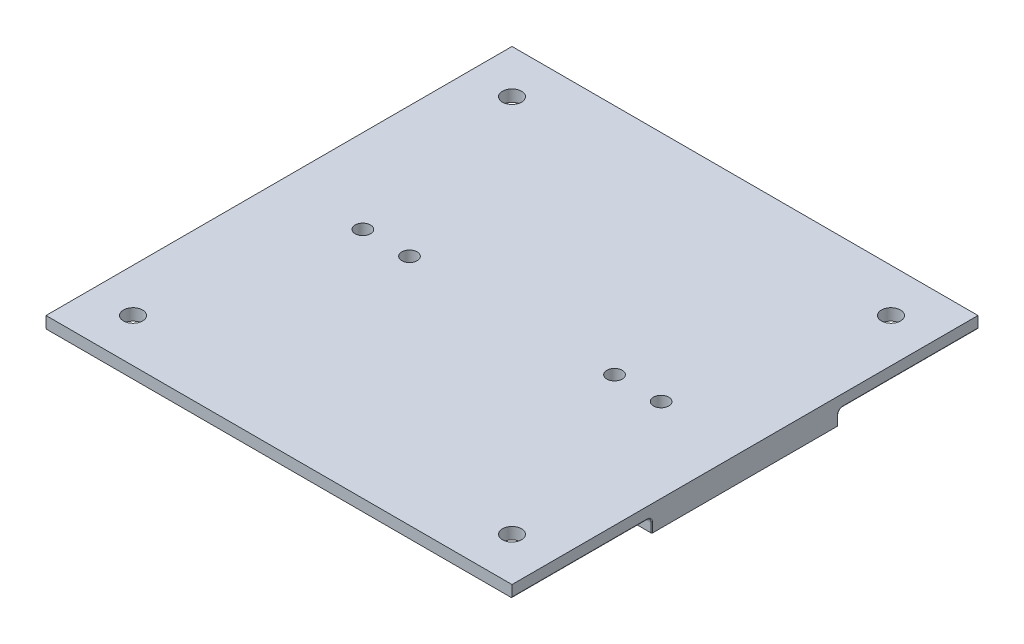
from build123d import *

# Parameters (mm, degrees)
SKETCH1_W           = 100
SKETCH1_H           = 100
SKETCH1_R           = 2.05
BOSS_EXTRUDE1_DEPTH = 2.5
SKETCH3_W           = 100
SKETCH3_H           = 40
BOSS_EXTRUDE2_DEPTH = 3
FILLET2_R           = 1
FILLET4_R           = 0.2
SKETCH4_R           = 1.65
CUT_EXTRUDE1_DEPTH  = 71.924255371


with BuildPart() as part:
    # Sketch1 → Boss-Extrude1 (new body)
    with BuildSketch(Plane(origin=(0, 0, 0), x_dir=(1, 0, 0), z_dir=(0, 1, 0))):
        Rectangle(SKETCH1_W, SKETCH1_H)
        with Locations(Location((-40.66, 40.66, 0), (0, 0, 270))):
            Circle(SKETCH1_R, mode=Mode.SUBTRACT)
        with Locations(Location((40.66, 40.66, 0), (0, 0, 270))):
            Circle(SKETCH1_R, mode=Mode.SUBTRACT)
        with Locations(Location((40.66, -40.66, 0), (0, 0, 270))):
            Circle(SKETCH1_R, mode=Mode.SUBTRACT)
        with Locations(Location((-40.66, -40.66, 0), (0, 0, 270))):
            Circle(SKETCH1_R, mode=Mode.SUBTRACT)
    extrude(amount=BOSS_EXTRUDE1_DEPTH)

    # Sketch3 → Boss-Extrude2 (add)
    with BuildSketch(Plane.XZ):
        Rectangle(SKETCH3_W, SKETCH3_H)
    extrude(amount=BOSS_EXTRUDE2_DEPTH)

    # Fillet2
    fillet2_edges = [part.edges().sort_by_distance(p)[0] for p in [
        (0, 0, 20),
        (0, 0, -20),
    ]]
    fillet(fillet2_edges, radius=FILLET2_R)

    # Fillet4
    fillet4_edges = [part.edges().sort_by_distance(p)[0] for p in [
        (50, -2, -20),
        (50, -2, 20),
        (-50, -2, 20),
        (-50, -2, -20),
        (50, 0, -35.5),
        (-50, 0, 35.5),
        (50, -0.292893219, -20.292893219),
        (-50, -0.292893219, -20.292893219),
        (-50, -0.292893219, 20.292893219),
        (50, -0.292893219, 20.292893219),
        (-50, 0, -35.5),
        (50, 0, 35.5),
    ]]
    fillet(fillet4_edges, radius=FILLET4_R)

    # Sketch4 → Cut-Extrude1 (cut, through all)
    with BuildSketch(Plane.XZ.offset(3)):
        with Locations(Location((-32, 0, 0), (0, 0, 270))):
            Circle(SKETCH4_R)
        with Locations(Location((-22, 0, 0), (0, 0, 270))):
            Circle(SKETCH4_R)
        with Locations(Location((22, 0, 0), (0, 0, 270))):
            Circle(SKETCH4_R)
        with Locations(Location((32, 0, 0), (0, 0, 270))):
            Circle(SKETCH4_R)
    extrude(amount=-CUT_EXTRUDE1_DEPTH, mode=Mode.SUBTRACT)


solid = part.part
